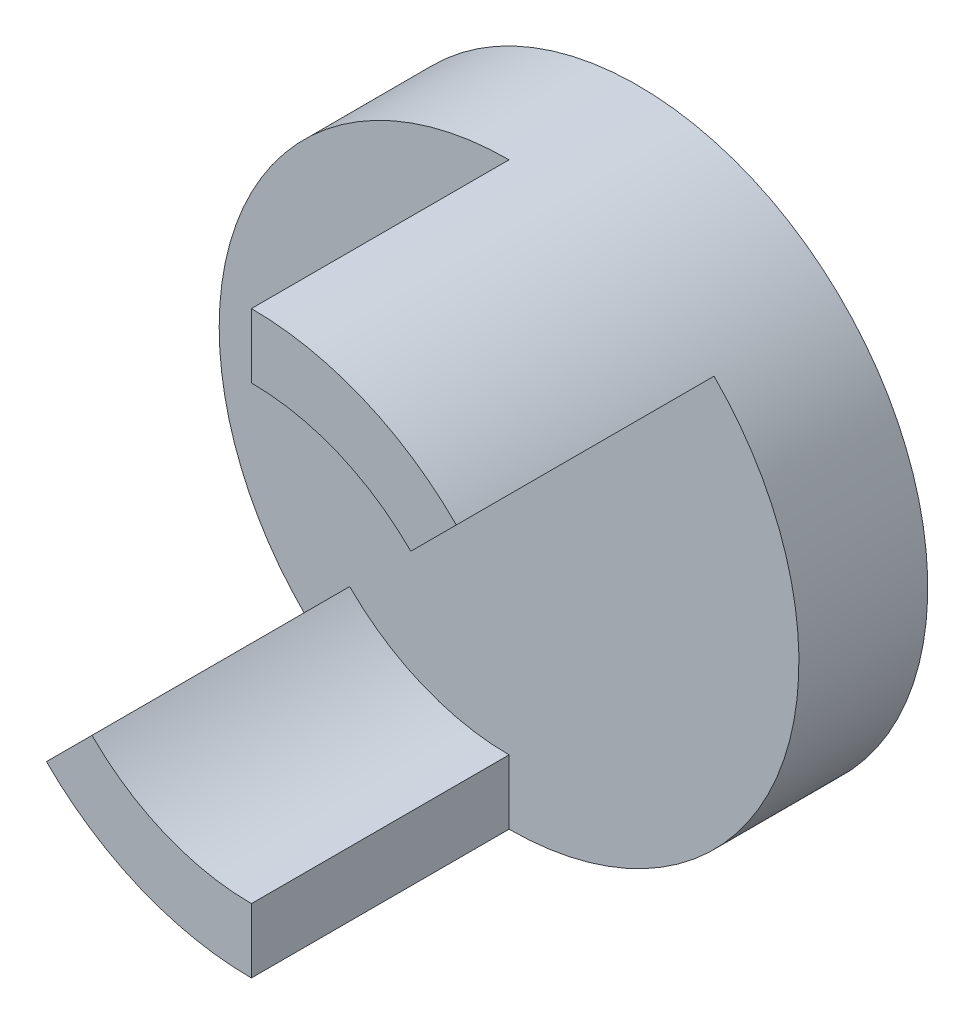
from build123d import *

# Parameters (mm, degrees)
SKETCH9_R           = 2.25
BOSS_EXTRUDE1_DEPTH = 2
SHELL1_T            = -1
CUT_EXTRUDE4_START  = -1
CUT_EXTRUDE4_DEPTH  = 1
BOSS_EXTRUDE2_START = 1
SKETCH11_R          = 2.25
BOSS_EXTRUDE2_DEPTH = 1
CUT_EXTRUDE5_START  = -2
CUT_EXTRUDE5_DEPTH  = 2
SKETCH13_R          = 1.75
CUT_EXTRUDE6_DEPTH  = 2


with BuildPart() as part:
    # Sketch9 → Boss-Extrude1 (new body)
    with BuildSketch(Plane.XY):
        Circle(SKETCH9_R)
    extrude(amount=BOSS_EXTRUDE1_DEPTH)

    # Shell1
    shell1_openings = [part.faces().sort_by_distance(p)[0] for p in [
        (0, 0, 2),
    ]]
    offset(amount=SHELL1_T, openings=shell1_openings, kind=Kind.INTERSECTION)

    # Sketch10 → Cut-Extrude4 (cut)
    with BuildSketch(Plane.XY.offset(2).offset(CUT_EXTRUDE4_START)):
        with BuildLine():
            ThreePointArc((-0.883883476, -0.883883476), (-1.154849416, 0.47835429), (0, 1.25))
            Line((0, 1.25), (0, 2.25))
            ThreePointArc((0, 2.25), (-2.078728948, 0.861037723), (-1.590990258, -1.590990258))
            Line((-1.590990258, -1.590990258), (-0.883883476, -0.883883476))
        make_face()
        with BuildLine():
            Line((1.590990258, 1.590990258), (0.883883476, 0.883883476))
            ThreePointArc((0.883883476, 0.883883476), (1.154849416, 0.47835429), (1.25, 0))
            ThreePointArc((1.25, 0), (0.883883476, -0.883883476), (0, -1.25))
            Line((0, -1.25), (0, -2.25))
            ThreePointArc((0, -2.25), (1.590990258, -1.590990258), (2.25, 0))
            ThreePointArc((2.25, 0), (2.078728948, 0.861037723), (1.590990258, 1.590990258))
        make_face()
    extrude(amount=CUT_EXTRUDE4_DEPTH, mode=Mode.SUBTRACT)

    # Sketch11 → Boss-Extrude2 (add)
    with BuildSketch(Plane(origin=(0, 0, 0), x_dir=(-1, 0, 0), z_dir=(0, 0, -1)).offset(BOSS_EXTRUDE2_START)):
        Circle(SKETCH11_R)
    extrude(amount=-BOSS_EXTRUDE2_DEPTH)

    # Sketch12 → Cut-Extrude5 (cut)
    with BuildSketch(Plane.XY.offset(2).offset(CUT_EXTRUDE5_START)):
        with BuildLine():
            Line((0, 1.25), (0, 2.25))
            ThreePointArc((0, 2.25), (-2.078728948, 0.861037723), (-1.590990258, -1.590990258))
            Line((-1.590990258, -1.590990258), (-0.883883476, -0.883883476))
            ThreePointArc((-0.883883476, -0.883883476), (-0.47835429, -1.154849416), (0, -1.25))
            Line((0, -1.25), (0, -2.25))
            ThreePointArc((0, -2.25), (2.078728948, -0.861037723), (1.590990258, 1.590990258))
            Line((1.590990258, 1.590990258), (0.883883476, 0.883883476))
            ThreePointArc((0.883883476, 0.883883476), (0.47835429, 1.154849416), (0, 1.25))
        make_face()
    extrude(amount=CUT_EXTRUDE5_DEPTH, mode=Mode.SUBTRACT)

    # Sketch13 → Cut-Extrude6 (cut)
    with BuildSketch(Plane.XY.offset(2)):
        Circle(SKETCH13_R)
    extrude(amount=-CUT_EXTRUDE6_DEPTH, mode=Mode.SUBTRACT)


solid = part.part
